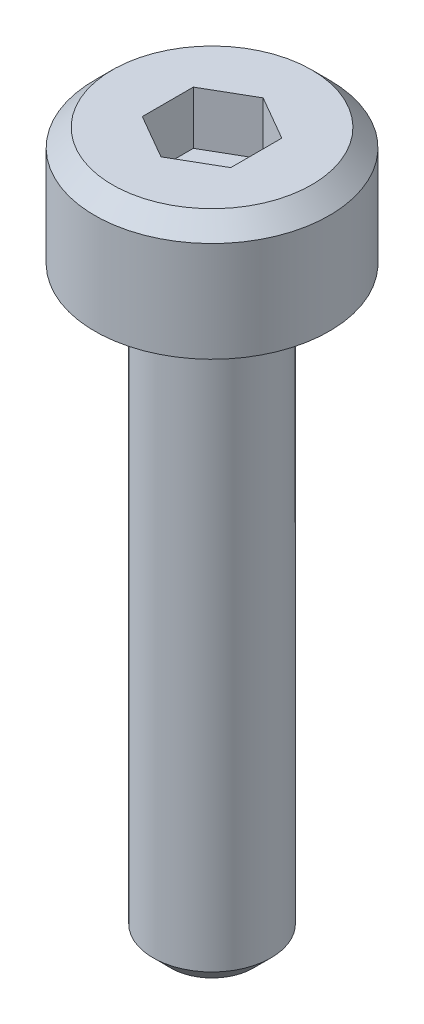
from build123d import *

# Parameters (mm, degrees)
CUT_EXTRUDE1_DEPTH = 0.9


with BuildPart() as part:
    # Sketch1 → Revolve1 (revolve)
    with BuildSketch(Plane.XY, mode=Mode.PRIVATE) as revolve1_sk:
        Polygon((0, -10), (0.7, -10), (1, -9.7), (1, 0), (1.99, 0), (1.99, 1.7), (1.69, 2), (0, 2), align=None)
    revolve(revolve1_sk.sketch.rotate(Axis((0, -10, 0), (0, 1, 0)), 90), axis=Axis((0, -10, 0), (0, 1, 0)))

    # Sketch2 → Cut-Extrude1 (cut)
    with BuildSketch(Plane(origin=(0, 2, 0), x_dir=(1, 0, 0), z_dir=(0, 1, 0))):
        Polygon((0.75, -0.433012702), (0, -0.866025404), (-0.75, -0.433012702), (-0.75, 0.433012702), (0, 0.866025404), (0.75, 0.433012702), align=None)
    extrude(amount=-CUT_EXTRUDE1_DEPTH, mode=Mode.SUBTRACT)


solid = part.part
